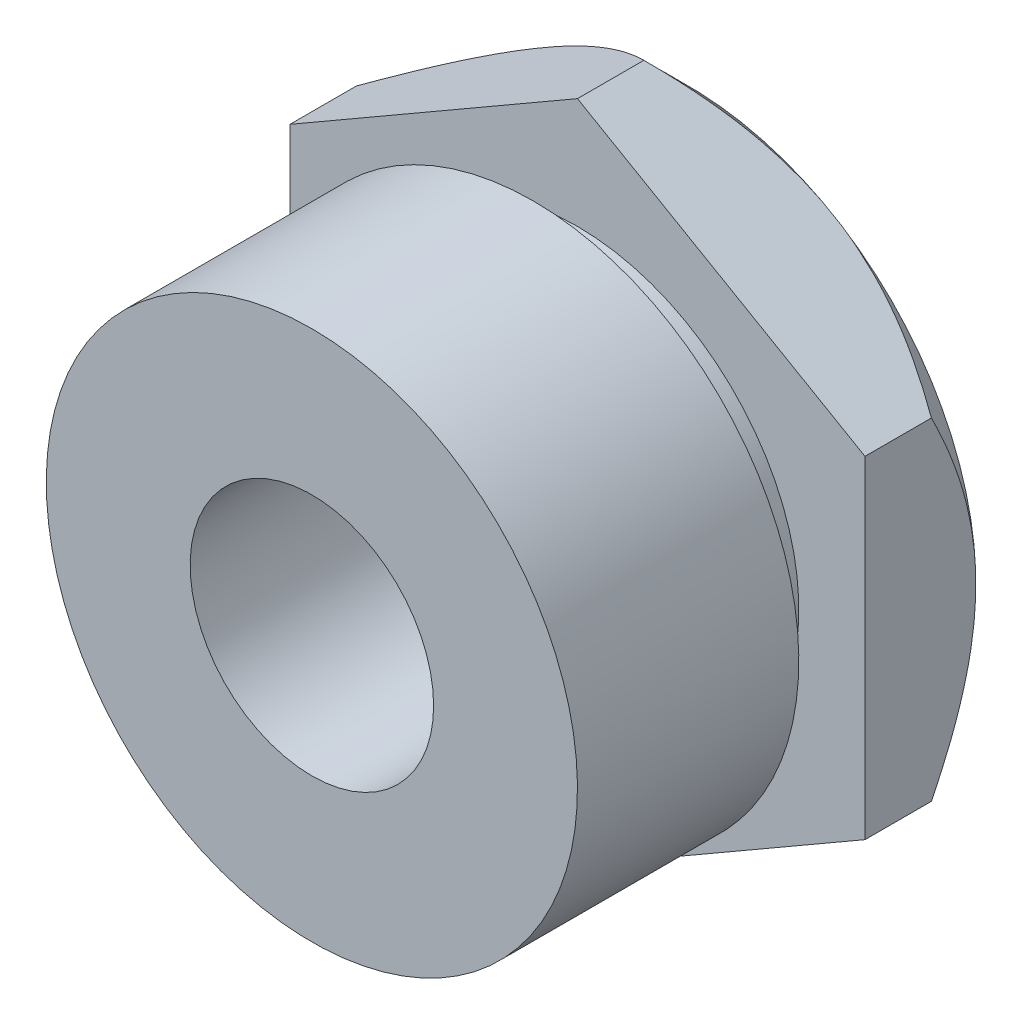
from build123d import *

# Parameters (mm, degrees)
CHAMFER_1_SIZE           = 2
CUT_EXTRUDE_1_DEPTH      = 28.184554438
CUT_EXTRUDE_1_DEPTH_BACK = 28.184554438
SKETCH_2_R               = 5.5
CUT_EXTRUDE_2_DEPTH      = 25.372115214
CUT_EXTRUDE_2_DEPTH_BACK = 25.372115214
SKETCH_3_OUTSIDE_W       = 41.142
SKETCH_3_OUTSIDE_H       = 41.142


with BuildPart() as part:
    # 草图1 → 旋转1 (revolve)
    with BuildSketch(Plane(origin=(0, 0, 0), x_dir=(0, 0, -1), z_dir=(1, 0, 0))):
        Polygon((-17, 0), (-17, 12), (-7, 12), (-7, 10), (-5, 10), (-5, 15), (0, 15), (0, 0), align=None)
    revolve(axis=Axis((0, 0, 0), (0, 0, 1)))

    # 倒角1
    chamfer_1_edges = [part.edges().sort_by_distance(p)[0] for p in [
        (0, -15, 0),
    ]]
    chamfer(chamfer_1_edges, length=CHAMFER_1_SIZE)

    # 草图2 → 切除-拉伸1 (cut, two sides: drawn at the far end of the back side and taken through both)
    with BuildSketch(Plane.XY.offset(17).offset(-CUT_EXTRUDE_1_DEPTH_BACK)):
        Circle(SKETCH_2_R)
    extrude(amount=CUT_EXTRUDE_1_DEPTH + CUT_EXTRUDE_1_DEPTH_BACK, mode=Mode.SUBTRACT)

    # 草图3 outside → 切除-拉伸2 (cut, two sides: drawn at the far end of the back side and taken through both)
    with BuildSketch(Plane.XY.offset(5).offset(-CUT_EXTRUDE_2_DEPTH_BACK)):
        Rectangle(SKETCH_3_OUTSIDE_W, SKETCH_3_OUTSIDE_H)
        Polygon((0, 15), (-12.990381057, 7.5), (-12.990381057, -7.5), (0, -15), (12.990381057, -7.5), (12.990381057, 7.5), align=None, mode=Mode.SUBTRACT)
    extrude(amount=CUT_EXTRUDE_2_DEPTH + CUT_EXTRUDE_2_DEPTH_BACK, mode=Mode.SUBTRACT)


solid = part.part
